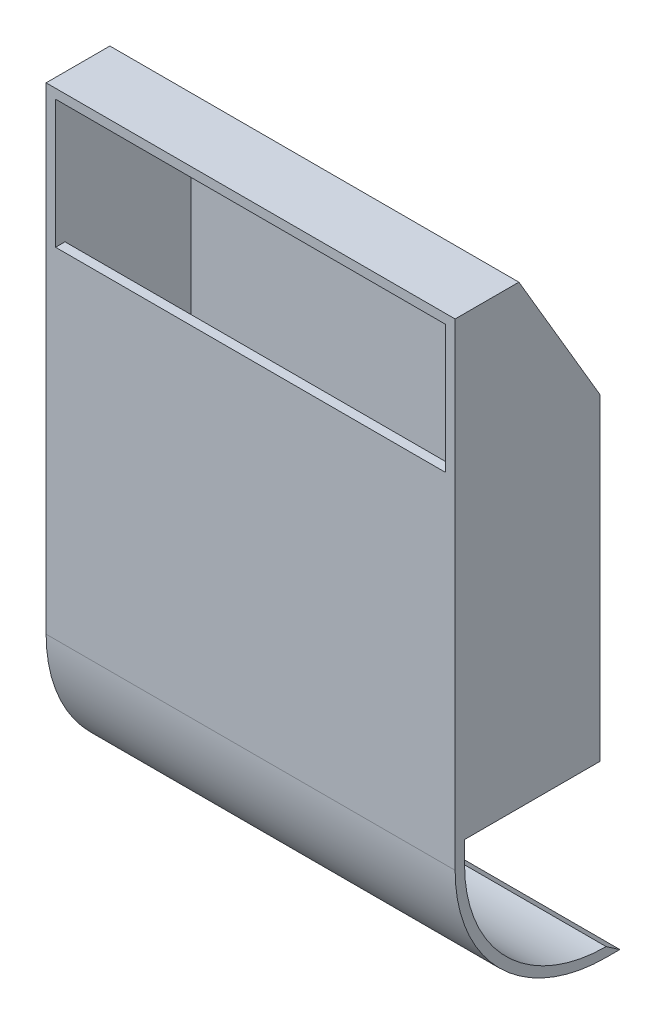
from build123d import *

# Parameters (mm, degrees)
BOSS_EXTRUDE1_DEPTH = 130
SKETCH2_W           = 3
SKETCH2_H           = 101.039132923
BOSS_EXTRUDE2_DEPTH = 40
SKETCH3_W           = 130
SKETCH3_H           = 101.039132923
BOSS_EXTRUDE3_DEPTH = 3
BOSS_EXTRUDE4_DEPTH = 130
BOSS_EXTRUDE5_DEPTH = 3
BOSS_EXTRUDE6_DEPTH = 3


with BuildPart() as part:
    # Sketch1 → Boss-Extrude1 (new body)
    with BuildSketch(Plane(origin=(0, 0, 0), x_dir=(0, 0, -1), z_dir=(1, 0, 0))):
        with BuildLine():
            Line((0, 0), (0, 108))
            Line((0, 108), (3, 108))
            Line((3, 108), (3, 0))
            ThreePointArc((3, 0), (16.180194847, -31.819805153), (48, -45))
            Line((48, -45), (52.371478475, -48))
            Line((52.371478475, -48), (48, -48))
            ThreePointArc((48, -48), (14.058874503, -33.941125497), (0, 0))
        make_face()
    extrude(amount=BOSS_EXTRUDE1_DEPTH)

    # Sketch2 → Boss-Extrude2 (add)
    with BuildSketch(Plane(origin=(0, 0, -3), x_dir=(-1, 0, 0), z_dir=(0, 0, -1))):
        with Locations((-128.5, 57.480433539)):
            Rectangle(SKETCH2_W, SKETCH2_H)
        with Locations((-1.5, 57.480433539)):
            Rectangle(SKETCH2_W, SKETCH2_H)
    extrude(amount=BOSS_EXTRUDE2_DEPTH)

    # Sketch3 → Boss-Extrude3 (add)
    with BuildSketch(Plane(origin=(0, 0, -43), x_dir=(-1, 0, 0), z_dir=(0, 0, -1))):
        with Locations((-65, 57.480433539)):
            Rectangle(SKETCH3_W, SKETCH3_H)
    extrude(amount=BOSS_EXTRUDE3_DEPTH)

    # Sketch5 → Boss-Extrude4 (add)
    with BuildSketch(Plane(origin=(130, 0, 0), x_dir=(0, 0, -1), z_dir=(1, 0, 0))):
        Polygon((43.040658043, 108), (19.504714564, 148.765449909), (0, 148.765449909), (0, 151.765449909), (20.265766112, 151.765449909), (46, 108), align=None)
    extrude(amount=-BOSS_EXTRUDE4_DEPTH)

    # Sketch6 → Boss-Extrude5 (add)
    with BuildSketch(Plane(origin=(130, 0, 0), x_dir=(0, 0, -1), z_dir=(1, 0, 0))):
        Polygon((43.040658043, 108), (0, 108), (0, 148.765449909), (19.504714564, 148.765449909), align=None)
    extrude(amount=-BOSS_EXTRUDE5_DEPTH)

    # Sketch7 → Boss-Extrude6 (add)
    with BuildSketch(Plane.ZY):
        Polygon((-43.040658043, 108), (0, 108), (0, 148.765449909), (-19.504714564, 148.765449909), align=None)
    extrude(amount=-BOSS_EXTRUDE6_DEPTH)


solid = part.part
